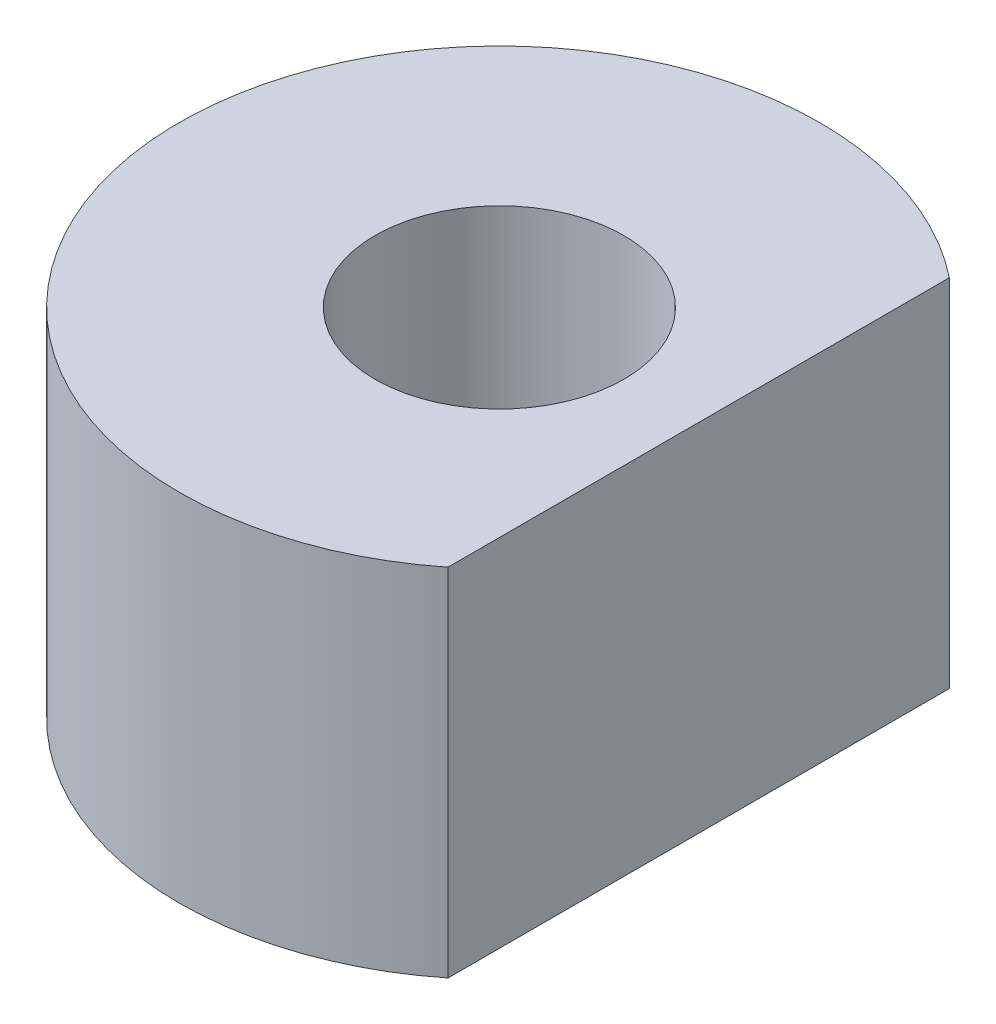
from build123d import *

# Parameters (mm, degrees)
SKETCH_2_R      = 1.75
EXTRUDE_1_DEPTH = 5


with BuildPart() as part:
    # 草图2 → 凸台-拉伸1 (new body)
    with BuildSketch(Plane(origin=(0, 0, 0), x_dir=(1, 0, 0), z_dir=(0, 1, 0))):
        with BuildLine():
            Line((2.8, -3.522782991), (2.8, 3.522782991))
            ThreePointArc((2.8, 3.522782991), (-4.5, 0), (2.8, -3.522782991))
        make_face()
        with Locations(Location((0, 0, 0), (0, 0, 270))):
            Circle(SKETCH_2_R, mode=Mode.SUBTRACT)
    extrude(amount=EXTRUDE_1_DEPTH)


solid = part.part
